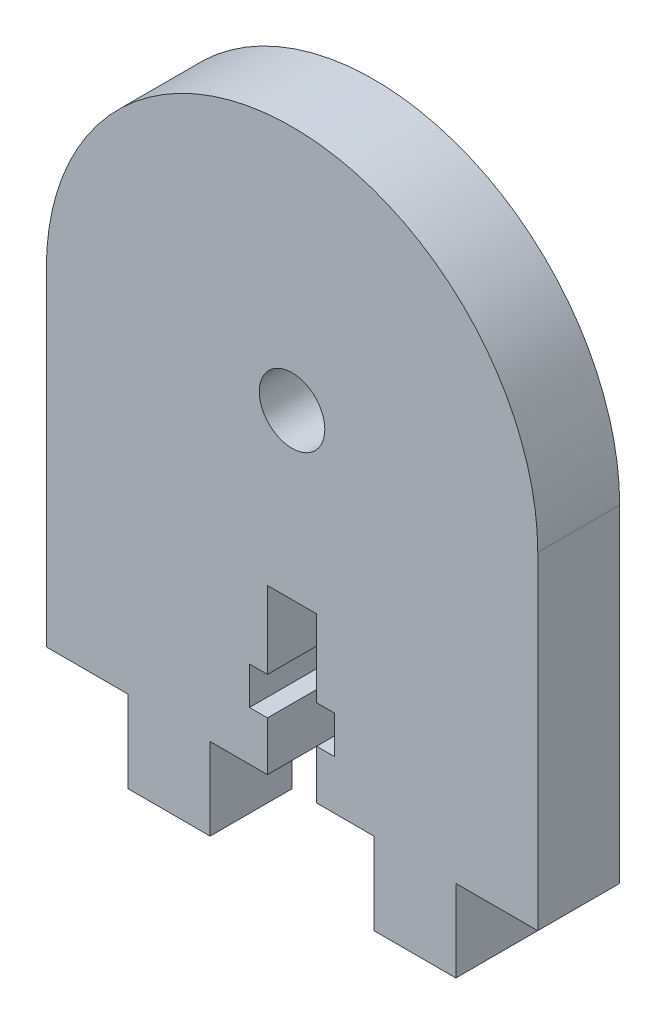
from build123d import *

# Parameters (mm, degrees)
SKETCH1_R           = 2
BOSS_EXTRUDE1_DEPTH = 5


with BuildPart() as part:
    # Sketch1 → Boss-Extrude1 (new body)
    with BuildSketch(Plane.XY):
        with BuildLine():
            Line((-10, 0), (-15, 0))
            Line((-15, 0), (-15, 20))
            ThreePointArc((-15, 20), (0, 35), (15, 20))
            Line((15, 20), (15, 0))
            Line((15, 0), (10, 0))
            Line((10, 0), (10, -5))
            Line((10, -5), (5, -5))
            Line((5, -5), (5, 0))
            Line((5, 0), (1.5, 0))
            Line((1.5, 0), (1.5, 3))
            Line((1.5, 3), (2.6, 3))
            Line((2.6, 3), (2.6, 5.3))
            Line((2.6, 5.3), (1.5, 5.3))
            Line((1.5, 5.3), (1.5, 10))
            Line((1.5, 10), (-1.5, 10))
            Line((-1.5, 10), (-1.5, 5.3))
            Line((-1.5, 5.3), (-2.6, 5.3))
            Line((-2.6, 5.3), (-2.6, 3))
            Line((-2.6, 3), (-1.5, 3))
            Line((-1.5, 3), (-1.5, 0))
            Line((-1.5, 0), (-5, 0))
            Line((-5, 0), (-5, -5))
            Line((-5, -5), (-10, -5))
            Line((-10, -5), (-10, 0))
        make_face()
        with Locations((0, 20)):
            Circle(SKETCH1_R, mode=Mode.SUBTRACT)
    extrude(amount=BOSS_EXTRUDE1_DEPTH)


solid = part.part
